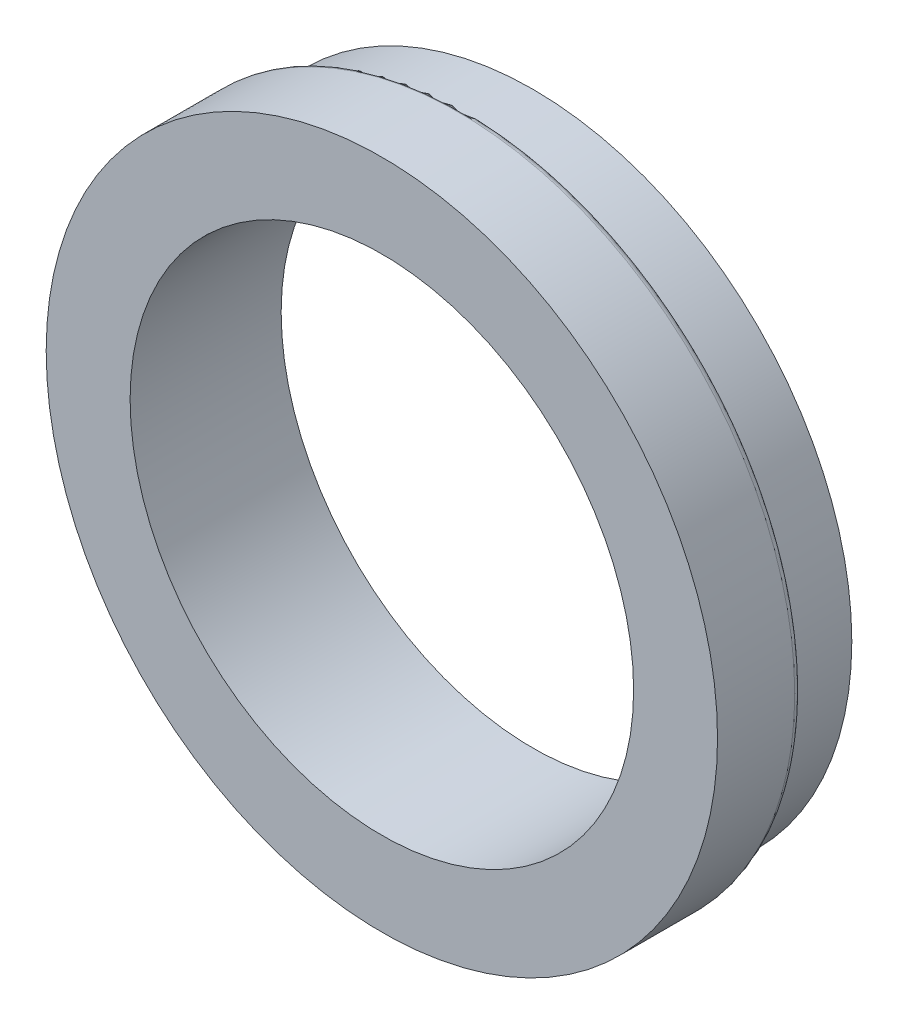
from build123d import *

# Parameters (mm, degrees)
SKIZZE2_R                       = 95
SKIZZE2_R_2                     = 75
AUFSATZ_LINEAR_AUSTRAGEN1_DEPTH = 20
SKIZZE3_W                       = 25
SKIZZE3_H                       = 25
VERRUNDUNG3_R                   = 2


with BuildPart() as part:
    # Skizze2 → Aufsatz-Linear austragen1 (new body)
    with BuildSketch(Plane.XY):
        Circle(SKIZZE2_R)
        Circle(SKIZZE2_R_2, mode=Mode.SUBTRACT)
    extrude(amount=AUFSATZ_LINEAR_AUSTRAGEN1_DEPTH)

    # Skizze3 → Rotation1 (revolve)
    with BuildSketch(Plane(origin=(0, 0, 0), x_dir=(1, 0, 0), z_dir=(0, 1, 0))):
        with Locations((87.5, -32.5)):
            Rectangle(SKIZZE3_W, SKIZZE3_H)
    revolve(axis=Axis((0, 0, 20), (0, 0, -1)))

    # Verrundung3
    verrundung3_edges = [part.edges().sort_by_distance(p)[0] for p in [
        (-100, 0, 20),
        (-95, 0, 20),
    ]]
    fillet(verrundung3_edges, radius=VERRUNDUNG3_R)


solid = part.part
